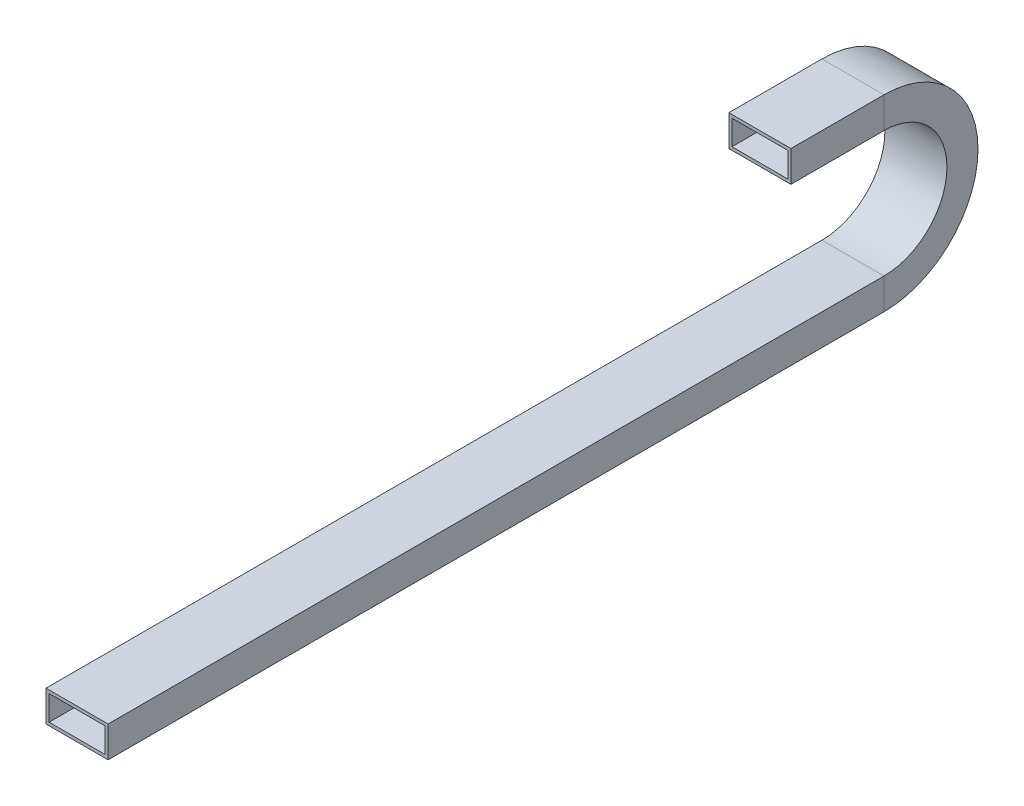
from build123d import *

# Parameters (mm, degrees)
ESQUISSE1_W   = 20
ESQUISSE1_H   = 10
ESQUISSE1_W_2 = 18
ESQUISSE1_H_2 = 8


with BuildPart() as part:
    # Balayage1: sweep along a path in Esquisse2
    with BuildLine(Plane(origin=(0, 0, 0), x_dir=(0, 0, -1), z_dir=(1, 0, 0))) as balayage1_path:
        Line((0, 2.284569244), (250, 2.284569244))
        ThreePointArc((250, 2.284569244), (278, 30.284569244), (250, 58.284569244))
        Line((250, 58.284569244), (220, 58.284569244))
    # Esquisse1 → Balayage1 (sweep)
    with BuildSketch(Plane.XY):
        with Locations((10, 5)):
            Rectangle(ESQUISSE1_W, ESQUISSE1_H)
        with Locations((10, 5)):
            Rectangle(ESQUISSE1_W_2, ESQUISSE1_H_2, mode=Mode.SUBTRACT)
    sweep(path=balayage1_path.line)


solid = part.part
